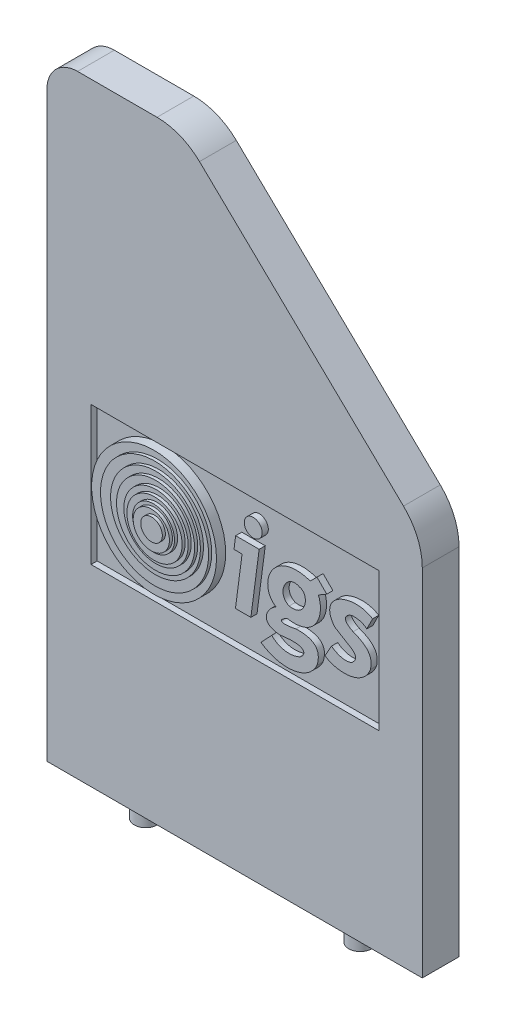
from build123d import *

# Parameters (mm, degrees)
SKETCH4_W                    = 122.5
SKETCH4_H                    = 200
BOSS_EXTRUDE1_DEPTH          = 12
CUT_EXTRUDE1_DEPTH           = 12
FILLET1_R                    = 20
FILLET2_R                    = 20
FILLET3_R                    = 10
SKETCH10_R                   = 3.75
BOSS_EXTRUDE3_DEPTH          = 6
F_5_0_5_DIAMETER_HOLE1_D     = 5
F_5_0_5_DIAMETER_HOLE1_DEPTH = 8
F_5_0_5_DIAMETER_HOLE1_TIP   = 1.502151548
F_5_0_5_DIAMETER_HOLE2_D     = 5
F_5_0_5_DIAMETER_HOLE2_DEPTH = 8
F_5_0_5_DIAMETER_HOLE2_TIP   = 1.502151548
SKETCH20_W                   = 93.935697293
SKETCH20_H                   = 45.241593882
SKETCH20_R                   = 20.37653906
SKETCH20_R_2                 = 2.92490685
CUT_EXTRUDE2_DEPTH           = 2
BOSS_EXTRUDE13_START         = 1
SKETCH20_13_R                = 20.37653906
SKETCH20_13_R_2              = 17.641529269
BOSS_EXTRUDE13_DEPTH         = 1
BOSS_EXTRUDE14_START         = 2
SKETCH20_14_R                = 17.641529269
SKETCH20_14_R_2              = 14.663672294
BOSS_EXTRUDE14_DEPTH         = 2
BOSS_EXTRUDE15_START         = 3
SKETCH20_15_R                = 14.663672294
SKETCH20_15_R_2              = 12.74550038
BOSS_EXTRUDE15_DEPTH         = 3
BOSS_EXTRUDE16_START         = 4
SKETCH20_16_R                = 12.74550038
SKETCH20_16_R_2              = 10.504948412
BOSS_EXTRUDE16_DEPTH         = 4
BOSS_EXTRUDE17_START         = 5
SKETCH20_17_R                = 10.504948412
SKETCH20_17_R_2              = 9.019824998
BOSS_EXTRUDE17_DEPTH         = 5
BOSS_EXTRUDE18_START         = 6
SKETCH20_18_R                = 9.019824998
SKETCH20_18_R_2              = 6.837562299
BOSS_EXTRUDE18_DEPTH         = 6
BOSS_EXTRUDE19_START         = 7
SKETCH20_19_R                = 6.837562299
SKETCH20_19_R_2              = 5.911229022
BOSS_EXTRUDE19_DEPTH         = 7
BOSS_EXTRUDE20_START         = 8
SKETCH20_20_R                = 5.911229022
SKETCH20_20_R_2              = 3.525742811
BOSS_EXTRUDE20_DEPTH         = 8
BOSS_EXTRUDE21_START         = 9
SKETCH20_21_R                = 3.525742811
BOSS_EXTRUDE21_DEPTH         = 9
CUT_EXTRUDE3_DEPTH           = 2


with BuildPart() as part:
    # Sketch4 → Boss-Extrude1 (new body)
    with BuildSketch(Plane.XY):
        with Locations((61.25, 100)):
            Rectangle(SKETCH4_W, SKETCH4_H)
    extrude(amount=BOSS_EXTRUDE1_DEPTH)

    # Sketch7 → Cut-Extrude1 (cut)
    with BuildSketch(Plane.XY.offset(12)):
        Polygon((43.985796602, 200), (122.5, 124.415794753), (122.5, 200), align=None)
    extrude(amount=-CUT_EXTRUDE1_DEPTH, mode=Mode.SUBTRACT)

    # Fillet1
    fillet1_edges = [part.edges().sort_by_distance(p)[0] for p in [
        (43.985796602, 200, 6),
    ]]
    fillet(fillet1_edges, radius=FILLET1_R)

    # Fillet2
    fillet2_edges = [part.edges().sort_by_distance(p)[0] for p in [
        (122.5, 124.415794753, 6),
    ]]
    fillet(fillet2_edges, radius=FILLET2_R)

    # Fillet3
    fillet3_edges = [part.edges().sort_by_distance(p)[0] for p in [
        (0, 200, 6),
    ]]
    fillet(fillet3_edges, radius=FILLET3_R)

    # Sketch10 → Boss-Extrude3 (add)
    with BuildSketch(Plane.XZ):
        with Locations((26.25, 6)):
            Circle(SKETCH10_R)
        with Locations((96.25, 6)):
            Circle(SKETCH10_R)
    extrude(amount=BOSS_EXTRUDE3_DEPTH)

    # Boss-Extrude4 cone 1 section (through the dimple's axis) → Boss-Extrude4 (revolve)
    with BuildSketch(Plane(origin=(26.25, -6, 6), x_dir=(0, 0, 1), z_dir=(1, 0, 0))):
        Polygon((0, 0), (3.75, 0), (0, 1.993910369), align=None)
    revolve(axis=Axis((26.25, -6, 6), (0, -1, 0)))

    # Boss-Extrude4 cone 2 section (through the dimple's axis) → Boss-Extrude4 cone 2 (revolve)
    with BuildSketch(Plane(origin=(96.25, -6, 6), x_dir=(0, 0, 1), z_dir=(1, 0, 0))):
        Polygon((0, 0), (3.75, 0), (0, 1.993910369), align=None)
    revolve(axis=Axis((96.25, -6, 6), (0, -1, 0)))

    # Ø5.0 (5) Diameter Hole1
    with Locations(Plane.ZY):
        with Locations((6, 180)):
            Hole(F_5_0_5_DIAMETER_HOLE1_D / 2, depth=F_5_0_5_DIAMETER_HOLE1_DEPTH)
            with Locations((0, 0, -(F_5_0_5_DIAMETER_HOLE1_DEPTH + F_5_0_5_DIAMETER_HOLE1_TIP / 2))):  # 118° drill point
                Cone(0, F_5_0_5_DIAMETER_HOLE1_D / 2, F_5_0_5_DIAMETER_HOLE1_TIP, mode=Mode.SUBTRACT)

    # Ø5.0 (5) Diameter Hole2
    with Locations(Plane.ZY):
        with Locations((6, 10)):
            Hole(F_5_0_5_DIAMETER_HOLE2_D / 2, depth=F_5_0_5_DIAMETER_HOLE2_DEPTH)
            with Locations((0, 0, -(F_5_0_5_DIAMETER_HOLE2_DEPTH + F_5_0_5_DIAMETER_HOLE2_TIP / 2))):  # 118° drill point
                Cone(0, F_5_0_5_DIAMETER_HOLE2_D / 2, F_5_0_5_DIAMETER_HOLE2_TIP, mode=Mode.SUBTRACT)

    # Sketch20 → Cut-Extrude2 (cut)
    with BuildSketch(Plane.XY.offset(12)):
        with Locations((61.361044033, 85.443809719)):
            Rectangle(SKETCH20_W, SKETCH20_H)
        Polygon((61.047573723, 90.430188609), (61.589041998, 94.557836932), (69.26029788, 94.557836932), (66.557469092, 73.953995083), (61.522270474, 73.953995083), (63.683630986, 90.430188609), align=None, mode=Mode.SUBTRACT)
        with BuildLine():
            add(Edge.make_bspline(
                [(85.962196211, 93.951535359), (73.227873525, 98.039311198), (68.565378269, 84.709913686), (74.817052307, 80.974792322)],
                knots=[0, 0, 0, 0, 1, 1, 1, 1], degree=3))
            Line((85.962196211, 93.951535359), (88.126726488, 96.116065636))
            Line((88.126726488, 96.116065636), (91.33219969, 92.910592434))
            Line((91.33219969, 92.910592434), (88.590187081, 91.316175115))
            add(Edge.make_bspline(
                [(88.590187081, 91.316175115), (90.608809275, 86.564684321), (88.195181264, 78.032608366), (78.503830219, 79.563349573)],
                knots=[0, 0, 0, 0, 1, 1, 1, 1], degree=3))
            add(Edge.make_bspline(
                [(78.503830219, 79.563349573), (75.106377316, 78.083857902), (76.155342876, 76.859276831), (81.296859197, 78.067290297)],
                knots=[0, 0, 0, 0, 1, 1, 1, 1], degree=3))
            add(Edge.make_bspline(
                [(88.126726488, 71.178977426), (90.353172606, 78.355431309), (81.296859197, 78.067290297)],
                knots=[0, 0, 0, 1, 1, 1], degree=2))
            add(Edge.make_bspline(
                [(69.883801172, 68.565818837), (75.441088702, 64.356763635), (85.007837919, 64.558881229), (88.126726488, 71.178977426)],
                knots=[0, 0, 0, 0, 1, 1, 1, 1], degree=3))
            Line((69.883801172, 68.565818837), (73.376875031, 72.316737458))
            add(Edge.make_bspline(
                [(82.35103605, 70.685834384), (79.070911802, 69.329587135), (75.410885248, 70.056928402), (73.376875031, 72.316737458)],
                knots=[0, 0, 0, 0, 1, 1, 1, 1], degree=3))
            add(Edge.make_bspline(
                [(75.937024541, 73.726414789), (86.193415253, 75.228814771), (84.157130117, 71.656945202), (82.35103605, 70.685834384)],
                knots=[0, 0, 0, 0, 1, 1, 1, 1], degree=3))
            add(Edge.make_bspline(
                [(74.817052307, 80.974792322), (72.922567337, 80.410121083), (68.041443, 74.528111598), (75.937024541, 73.726414789)],
                knots=[0, 0, 0, 0, 1, 1, 1, 1], degree=3))
        make_face(mode=Mode.SUBTRACT)
        with BuildLine():
            Line((90.750865037, 75.226412858), (92.89504628, 79.029138763))
            add(Edge.make_bspline(
                [(99.911414016, 78.067290297), (98.958240769, 76.804379248), (95.34669814, 76.970567767), (92.89504628, 79.029138763)],
                knots=[0, 0, 0, 0, 1, 1, 1, 1], degree=3))
            add(Edge.make_bspline(
                [(93.854204775, 84.969216201), (98.026734503, 82.096686967), (102.640223397, 80.959953656), (99.911414016, 78.067290297)],
                knots=[0, 0, 0, 0, 1, 1, 1, 1], degree=3))
            add(Edge.make_bspline(
                [(106.283646559, 93.405127221), (100.031028138, 97.418853716), (87.983706785, 92.678641198), (93.854204775, 84.969216201)],
                knots=[0, 0, 0, 0, 1, 1, 1, 1], degree=3))
            Line((106.283646559, 93.405127221), (104.379710297, 89.598437986))
            add(Edge.make_bspline(
                [(100.146227503, 90.991779166), (102.860896641, 91.009835078), (104.379710297, 89.598437986)],
                knots=[0, 0, 0, 1, 1, 1], degree=2))
            add(Edge.make_bspline(
                [(99.911414016, 86.581431975), (94.755138706, 89.086680248), (99.08096527, 91.263500215), (100.146227503, 90.991779166)],
                knots=[0, 0, 0, 0, 1, 1, 1, 1], degree=3))
            add(Edge.make_bspline(
                [(105.582611154, 78.774413912), (106.459148582, 82.651459105), (104.591855241, 84.842143282), (99.911414016, 86.581431975)],
                knots=[0, 0, 0, 0, 1, 1, 1, 1], degree=3))
            add(Edge.make_bspline(
                [(90.750865037, 75.226412858), (94.291366297, 72.653681958), (103.101226044, 72.066278851), (105.582611154, 78.774413912)],
                knots=[0, 0, 0, 0, 1, 1, 1, 1], degree=3))
        make_face(mode=Mode.SUBTRACT)
        with Locations((35.957607669, 86.013822807)):
            Circle(SKETCH20_R, mode=Mode.SUBTRACT)
        with Locations((67.322275412, 99.697516532)):
            Circle(SKETCH20_R_2, mode=Mode.SUBTRACT)
    extrude(amount=-CUT_EXTRUDE2_DEPTH, mode=Mode.SUBTRACT)

    # Sketch20<13> → Boss-Extrude13 (add)
    with BuildSketch(Plane.XY.offset(12).offset(BOSS_EXTRUDE13_START)):
        with Locations((35.957607669, 86.013822807)):
            Circle(SKETCH20_13_R)
        with Locations((37.119063244, 86.818761809)):
            Circle(SKETCH20_13_R_2, mode=Mode.SUBTRACT)
    extrude(amount=-BOSS_EXTRUDE13_DEPTH)

    # Sketch20<14> → Boss-Extrude14 (add)
    with BuildSketch(Plane.XY.offset(12).offset(BOSS_EXTRUDE14_START)):
        with Locations((37.119063244, 86.818761809)):
            Circle(SKETCH20_14_R)
        with Locations((38.428612543, 88.108007113)):
            Circle(SKETCH20_14_R_2, mode=Mode.SUBTRACT)
    extrude(amount=-BOSS_EXTRUDE14_DEPTH)

    # Sketch20<15> → Boss-Extrude15 (add)
    with BuildSketch(Plane.XY.offset(12).offset(BOSS_EXTRUDE15_START)):
        with Locations((38.428612543, 88.108007113)):
            Circle(SKETCH20_15_R)
        with Locations((39.441974393, 88.428639811)):
            Circle(SKETCH20_15_R_2, mode=Mode.SUBTRACT)
    extrude(amount=-BOSS_EXTRUDE15_DEPTH)

    # Sketch20<16> → Boss-Extrude16 (add)
    with BuildSketch(Plane.XY.offset(12).offset(BOSS_EXTRUDE16_START)):
        with Locations((39.441974393, 88.428639811)):
            Circle(SKETCH20_16_R)
        with Locations((40.593265286, 89.13526511)):
            Circle(SKETCH20_16_R_2, mode=Mode.SUBTRACT)
    extrude(amount=-BOSS_EXTRUDE16_DEPTH)

    # Sketch20<17> → Boss-Extrude17 (add)
    with BuildSketch(Plane.XY.offset(12).offset(BOSS_EXTRUDE17_START)):
        with Locations((40.593265286, 89.13526511)):
            Circle(SKETCH20_17_R)
        with Locations((41.099946211, 89.295581459)):
            Circle(SKETCH20_17_R_2, mode=Mode.SUBTRACT)
    extrude(amount=-BOSS_EXTRUDE17_DEPTH)

    # Sketch20<18> → Boss-Extrude18 (add)
    with BuildSketch(Plane.XY.offset(12).offset(BOSS_EXTRUDE18_START)):
        with Locations((41.099946211, 89.295581459)):
            Circle(SKETCH20_18_R)
        with Locations((41.79537959, 90.333458923)):
            Circle(SKETCH20_18_R_2, mode=Mode.SUBTRACT)
    extrude(amount=-BOSS_EXTRUDE18_DEPTH)

    # Sketch20<19> → Boss-Extrude19 (add)
    with BuildSketch(Plane.XY.offset(12).offset(BOSS_EXTRUDE19_START)):
        with Locations((41.79537959, 90.333458923)):
            Circle(SKETCH20_19_R)
        with Locations((42.054997992, 90.430188609)):
            Circle(SKETCH20_19_R_2, mode=Mode.SUBTRACT)
    extrude(amount=-BOSS_EXTRUDE19_DEPTH)

    # Sketch20<20> → Boss-Extrude20 (add)
    with BuildSketch(Plane.XY.offset(12).offset(BOSS_EXTRUDE20_START)):
        with Locations((42.054997992, 90.430188609)):
            Circle(SKETCH20_20_R)
        with Locations((43.134317697, 91.60779599)):
            Circle(SKETCH20_20_R_2, mode=Mode.SUBTRACT)
    extrude(amount=-BOSS_EXTRUDE20_DEPTH)

    # Sketch20<21> → Boss-Extrude21 (add)
    with BuildSketch(Plane.XY.offset(12).offset(BOSS_EXTRUDE21_START)):
        with Locations((43.134317697, 91.60779599)):
            Circle(SKETCH20_21_R)
    extrude(amount=-BOSS_EXTRUDE21_DEPTH)

    # Sketch20<22> → Cut-Extrude3 (cut)
    with BuildSketch(Plane.XY.offset(12)):
        with BuildLine():
            add(Edge.make_bspline(
                [(82.50679273, 90.430188609), (85.773261611, 89.84410729), (84.718395856, 82.229894915), (79.062431364, 83.437020603)],
                knots=[0, 0, 0, 0, 1, 1, 1, 1], degree=3))
            add(Edge.make_bspline(
                [(82.50679273, 90.430188609), (78.139071085, 92.768466485), (74.677374815, 85.246681766), (79.062431364, 83.437020603)],
                knots=[0, 0, 0, 0, 1, 1, 1, 1], degree=3))
        make_face()
    extrude(amount=-CUT_EXTRUDE3_DEPTH, mode=Mode.SUBTRACT)


solid = part.part
